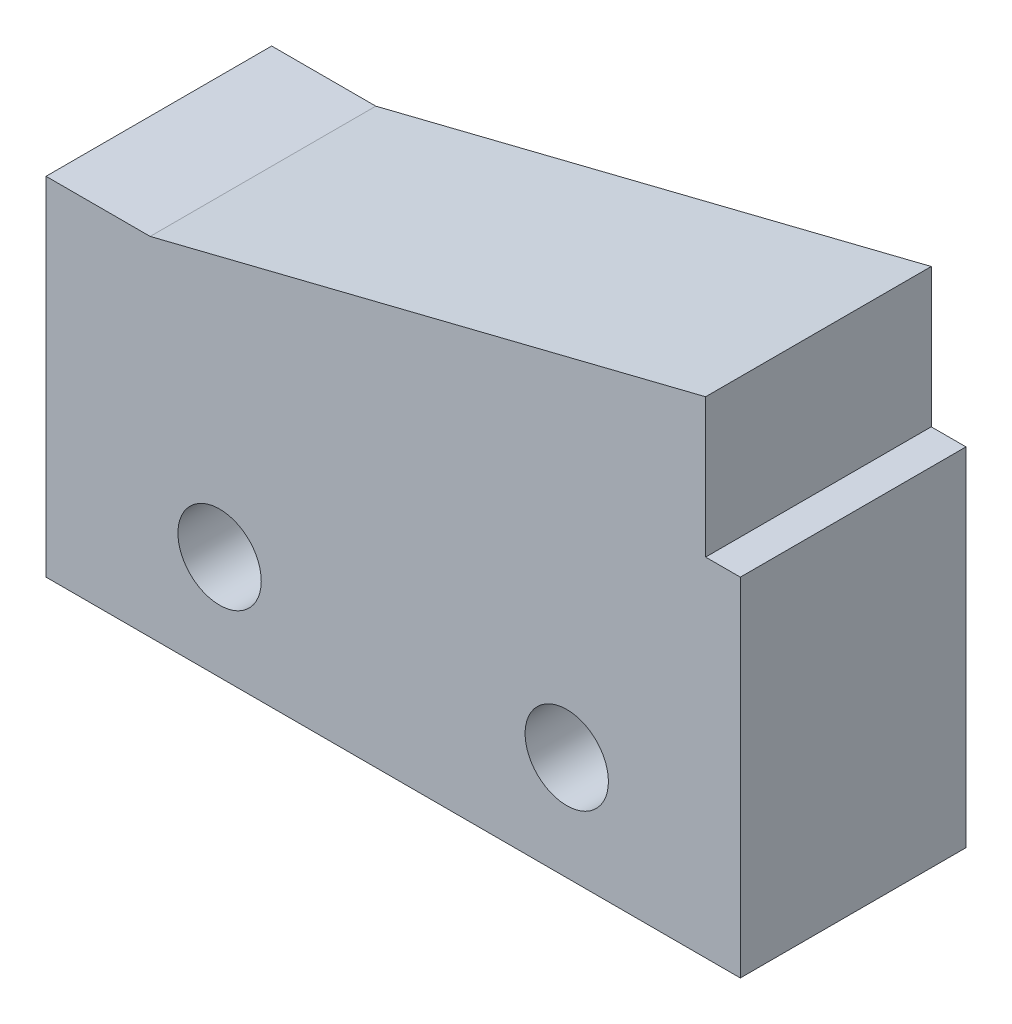
from build123d import *

# Parameters (mm, degrees)
SKETCH1_W            = 20
SKETCH1_H            = 10
BOSS_EXTRUDE1_DEPTH  = 6.5
M2_CLEARANCE_HOLE1_D = 2.4


with BuildPart() as part:
    # Sketch1 → Boss-Extrude1 (new body)
    with BuildSketch(Plane.XY):
        Polygon((19, 14), (3, 10), (19, 10), align=None)
        with Locations((10, 5)):
            Rectangle(SKETCH1_W, SKETCH1_H)
    extrude(amount=BOSS_EXTRUDE1_DEPTH)

    # M2 Clearance Hole1 (through all)
    with Locations(Plane.XY.offset(6.5)):
        with Locations((5, 3), (15, 3)):
            Hole(M2_CLEARANCE_HOLE1_D / 2)


solid = part.part
